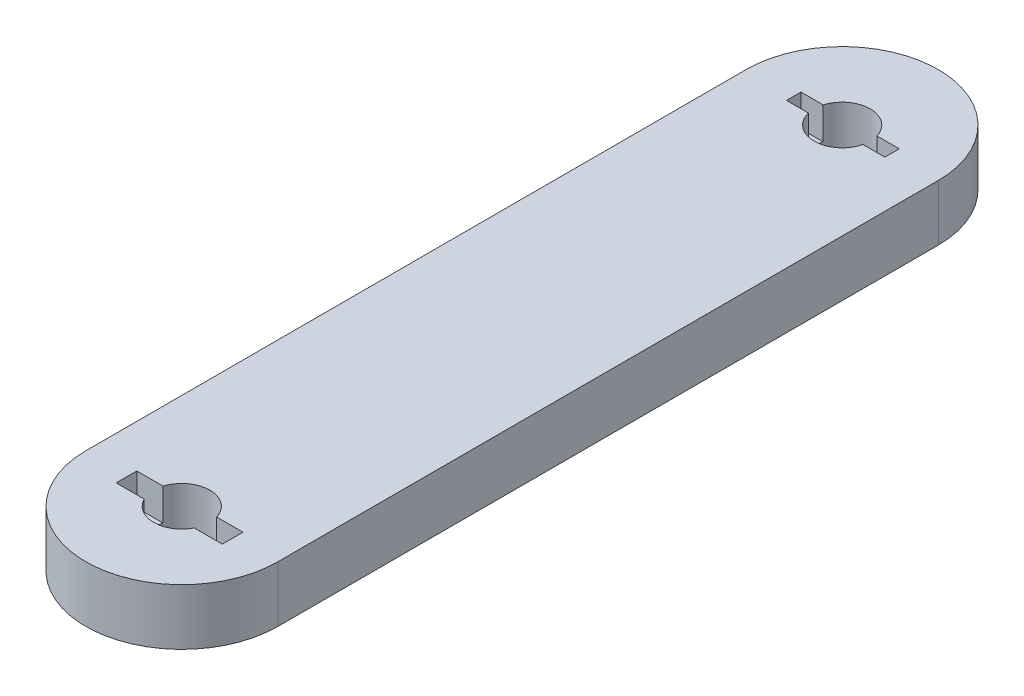
from build123d import *

# Parameters (mm, degrees)
SKETCH1_R           = 3.5
BOSS_EXTRUDE1_DEPTH = 7
SKETCH2_W           = 13.256743243
SKETCH2_H           = 2.580958861
SKETCH2_W_2         = 12.276635078
SKETCH2_H_2         = 1.8
CUT_EXTRUDE1_DEPTH  = 4


with BuildPart() as part:
    # Sketch1 → Boss-Extrude1 (new body)
    with BuildSketch(Plane(origin=(0, 0, 0), x_dir=(1, 0, 0), z_dir=(0, 1, 0))):
        with BuildLine():
            Line((-12, 41.25), (-12, -41.25))
            ThreePointArc((-12, -41.25), (0, -53.25), (12, -41.25))
            Line((12, -41.25), (12, 41.25))
            ThreePointArc((12, 41.25), (0, 53.25), (-12, 41.25))
        make_face()
        with Locations(Location((0, 41.25, 0), (0, 0, 270))):
            Circle(SKETCH1_R, mode=Mode.SUBTRACT)
        with Locations(Location((0, -41.25, 0), (0, 0, 270))):
            Circle(SKETCH1_R, mode=Mode.SUBTRACT)
    extrude(amount=BOSS_EXTRUDE1_DEPTH)

    # Sketch2 → Cut-Extrude1 (cut)
    with BuildSketch(Plane(origin=(0, 7, 0), x_dir=(1, 0, 0), z_dir=(0, 1, 0))):
        with Locations((-0.004439632, -41.523432512)):
            Rectangle(SKETCH2_W, SKETCH2_H)
        with Locations((0, 41.335850456)):
            Rectangle(SKETCH2_W_2, SKETCH2_H_2)
    extrude(amount=-CUT_EXTRUDE1_DEPTH, mode=Mode.SUBTRACT)


solid = part.part
